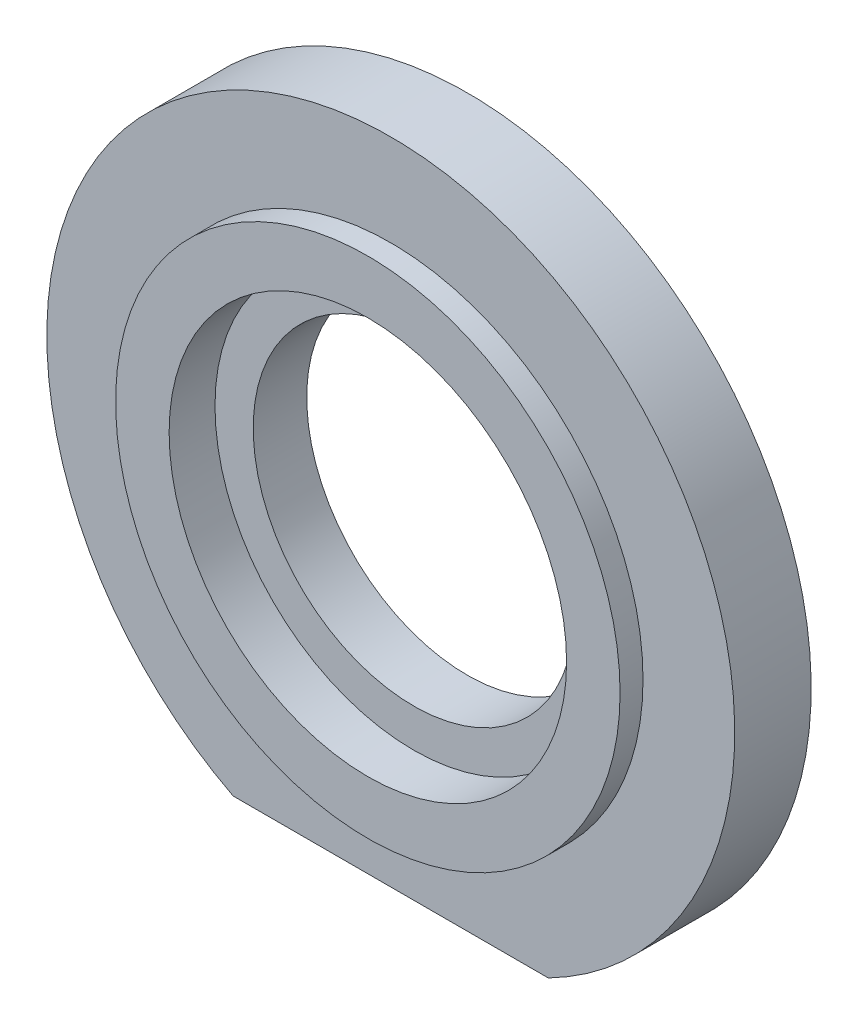
from build123d import *

# Parameters (mm, degrees)
SKETCH_1_R          = 45
SKETCH_1_R_2        = 21
EXTRUDE_1_DEPTH     = 10
SKETCH_2_R          = 33
SKETCH_2_R_2        = 21
EXTRUDE_2_DEPTH     = 3
CUT_EXTRUDE_1_DEPTH = 88.964820488
SKETCH_5_R          = 26
CUT_EXTRUDE_2_DEPTH = 6


with BuildPart() as part:
    # 草图1 → 凸台-拉伸1 (new body)
    with BuildSketch(Plane.XY):
        with Locations((0, 29.456763584)):
            Circle(SKETCH_1_R)
        with Locations((0, 29.456763584)):
            Circle(SKETCH_1_R_2, mode=Mode.SUBTRACT)
    extrude(amount=EXTRUDE_1_DEPTH)

    # 草图2 → 凸台-拉伸2 (add)
    with BuildSketch(Plane.XY.offset(10)):
        with Locations((0, 29.456763584)):
            Circle(SKETCH_2_R)
        with Locations((0, 29.456763584)):
            Circle(SKETCH_2_R_2, mode=Mode.SUBTRACT)
    extrude(amount=EXTRUDE_2_DEPTH)

    # 草图4 → 切除-拉伸1 (cut, through all)
    with BuildSketch(Plane(origin=(0, 0, 0), x_dir=(-1, 0, 0), z_dir=(0, 0, -1))):
        with BuildLine():
            Line((-20.615528128, -10.543236416), (20.615528128, -10.543236416))
            ThreePointArc((20.615528128, -10.543236416), (0, -15.543236416), (-20.615528128, -10.543236416))
        make_face()
    extrude(amount=-CUT_EXTRUDE_1_DEPTH, mode=Mode.SUBTRACT)

    # 草图5 → 切除-拉伸2 (cut)
    with BuildSketch(Plane.XY.offset(13)):
        with Locations((0, 29.456763584)):
            Circle(SKETCH_5_R)
    extrude(amount=-CUT_EXTRUDE_2_DEPTH, mode=Mode.SUBTRACT)


solid = part.part
